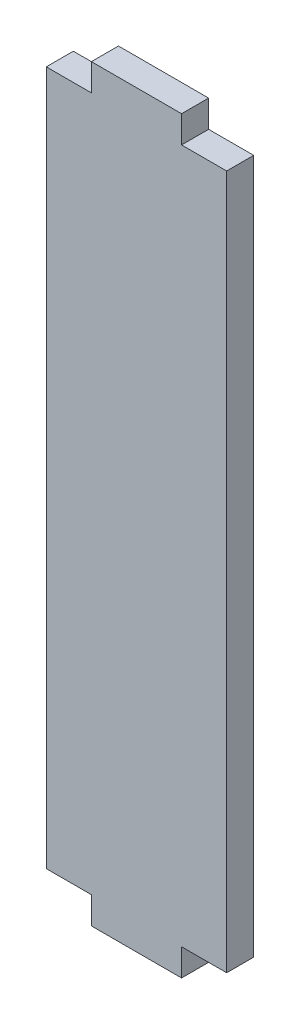
from build123d import *

# Parameters (mm, degrees)
BOSS_EXTRUDE1_DEPTH = 3


with BuildPart() as part:
    # Sketch2 → Boss-Extrude1 (new body)
    with BuildSketch(Plane.XY):
        Polygon((5, 38.5), (5, 41.5), (-5, 41.5), (-5, 38.5), (-10, 38.5), (-10, -38.5), (-5, -38.5), (-5, -41.5), (5, -41.5), (5, -38.5), (10, -38.5), (10, 38.5), align=None)
    extrude(amount=BOSS_EXTRUDE1_DEPTH)


solid = part.part
